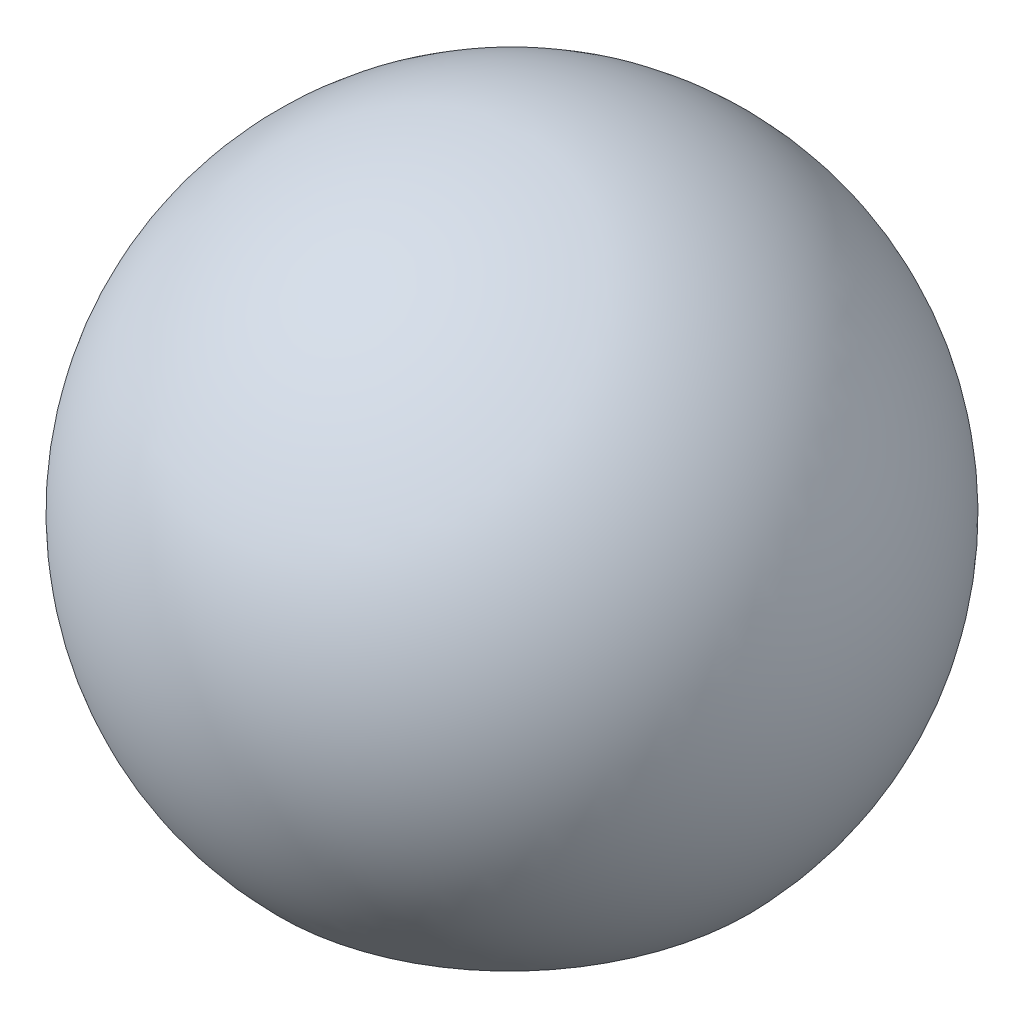
from build123d import *


with BuildPart() as part:
    # Sketch2 → Revolve3 (revolve)
    with BuildSketch(Plane.XY):
        with BuildLine():
            Line((0, 0), (-3.610869979, 150))
            ThreePointArc((-3.610869979, 150), (-140.094600977, 53.726540546), (-102.984112733, -109.120625487))
            Line((-102.984112733, -109.120625487), (2.626802604, -109.120625487))
            Line((2.626802604, -109.120625487), (0, 0))
        make_face()
    revolve(axis=Axis((0, 0, 0), (-0.024065494756838147, 0.9997103840423529, 0)))


solid = part.part
